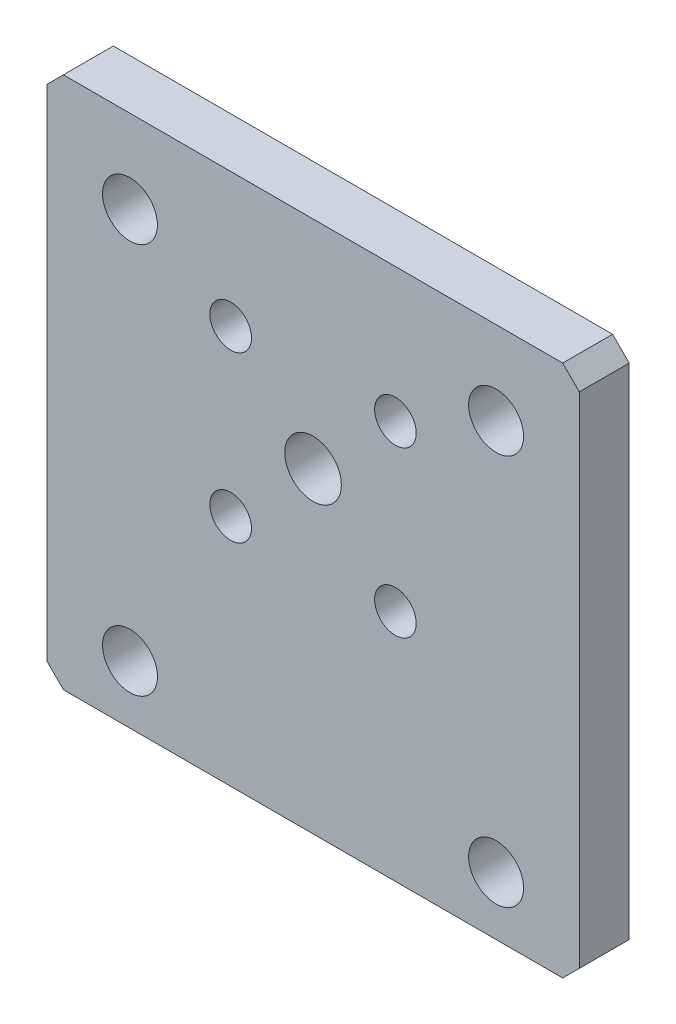
from build123d import *

# Parameters (mm, degrees)
SKETCH_1_W                  = 32
SKETCH_1_H                  = 32
EXTRUDE_1_DEPTH             = 3
HOLE_WIZARD_3_4_3_4_1_D     = 3.4
HOLE_WIZARD_3_4_3_4_1_DEPTH = 6
HOLE_WIZARD_3_4_3_4_1_TIP   = 1.021463052
PATTERN_CIRCULAR_1_COUNT    = 4
HOLE_WIZARD_M4_1_D          = 3.3
CHAMFER_1_SIZE              = 1


with BuildPart() as part:
    # 草图1 → 凸台-拉伸1 (new body)
    with BuildSketch(Plane.XY):
        with Locations((0, -3)):
            Rectangle(SKETCH_1_W, SKETCH_1_H)
    extrude(amount=EXTRUDE_1_DEPTH)

    # Ø3.4 (3.4) 直径孔1
    with Locations(Plane.XY.offset(3)):
        with Locations((0, 0)):
            Hole(HOLE_WIZARD_3_4_3_4_1_D / 2, depth=HOLE_WIZARD_3_4_3_4_1_DEPTH)
            with Locations((0, 0, -(HOLE_WIZARD_3_4_3_4_1_DEPTH + HOLE_WIZARD_3_4_3_4_1_TIP / 2))):  # 118° drill point
                Cone(0, HOLE_WIZARD_3_4_3_4_1_D / 2, HOLE_WIZARD_3_4_3_4_1_TIP, mode=Mode.SUBTRACT)

    # 草图4 → M3 螺纹孔1 (revolve, cut)
    with BuildSketch(Plane(origin=(-4.949747468, -4.949747468, 3), x_dir=(0, -1, 0), z_dir=(1, 0, 0))):
        Polygon((0, 0), (0, 9.251075774), (1.25, 8.5), (1.25, 0), align=None)
    hole_wizard_m3_1 = revolve(axis=Axis((-4.949747468, -4.949747468, 9.35), (0, 0, -1)), mode=Mode.SUBTRACT)

    # 阵列(圆周)1: M3 螺纹孔1 ×4 about axis
    pattern_circular_1_axis = Axis((0, 0, 0), (0, 0, 1))
    for i in range(1, PATTERN_CIRCULAR_1_COUNT):
        add(hole_wizard_m3_1.rotate(pattern_circular_1_axis, i * 360 / PATTERN_CIRCULAR_1_COUNT), mode=Mode.SUBTRACT)

    # M4 螺纹孔1 (through all)
    with Locations(Plane.XY.offset(3)):
        with Locations((-11, 8), (11, 8), (-11, -15.5), (11, -15.5)):
            Hole(HOLE_WIZARD_M4_1_D / 2)

    # 倒角1
    chamfer_1_edges = [part.edges().sort_by_distance(p)[0] for p in [
        (-16, 13, 1.5),
        (16, 13, 1.5),
        (16, -19, 1.5),
        (-16, -19, 1.5),
    ]]
    chamfer(chamfer_1_edges, length=CHAMFER_1_SIZE)


solid = part.part
